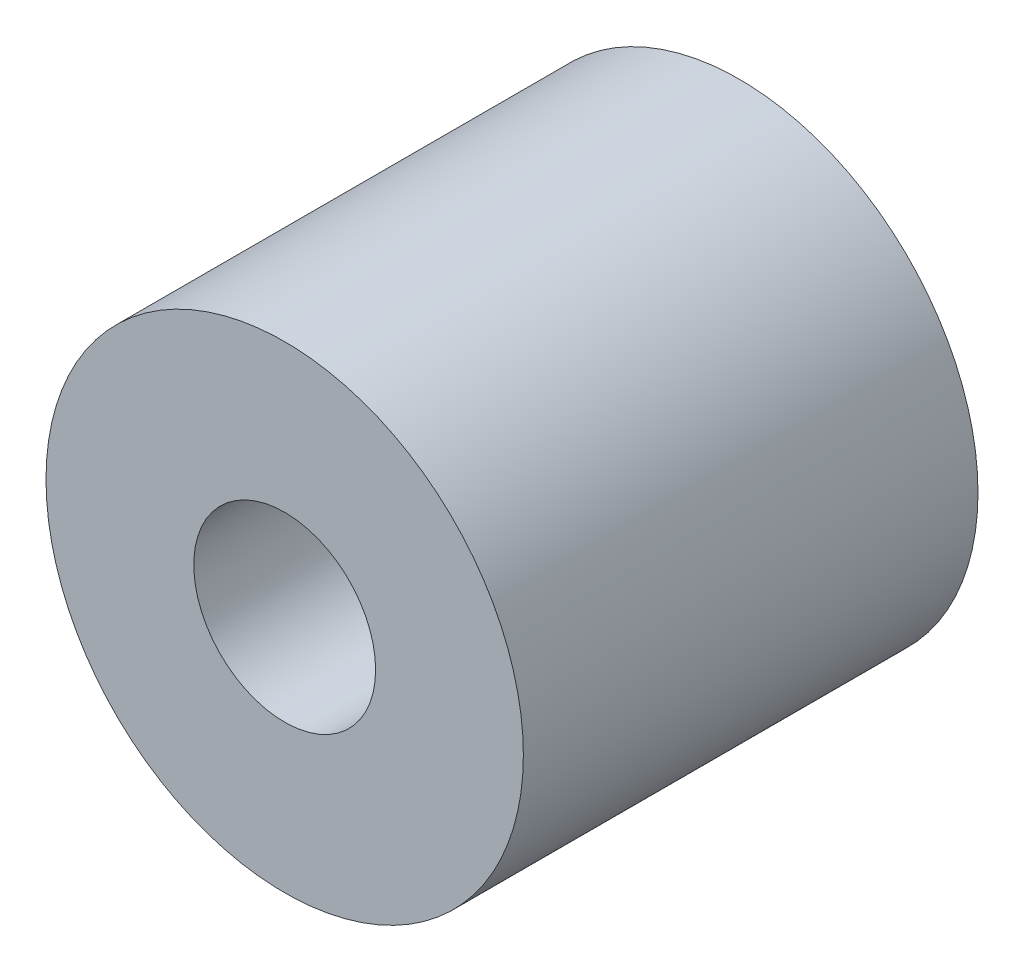
from build123d import *

# Parameters (mm, degrees)
SKETCH_1_R          = 10.5
EXTRUDE_1_DEPTH     = 20
SKETCH_2_R          = 4
CUT_EXTRUDE_1_DEPTH = 20


with BuildPart() as part:
    # Эскиз1 → Бобышка-Вытянуть1 (new body)
    with BuildSketch(Plane.XY):
        Circle(SKETCH_1_R)
    extrude(amount=EXTRUDE_1_DEPTH)

    # Эскиз2 → Вырез-Вытянуть1 (cut)
    with BuildSketch(Plane.XY.offset(20)):
        Circle(SKETCH_2_R)
    extrude(amount=-CUT_EXTRUDE_1_DEPTH, mode=Mode.SUBTRACT)


solid = part.part
